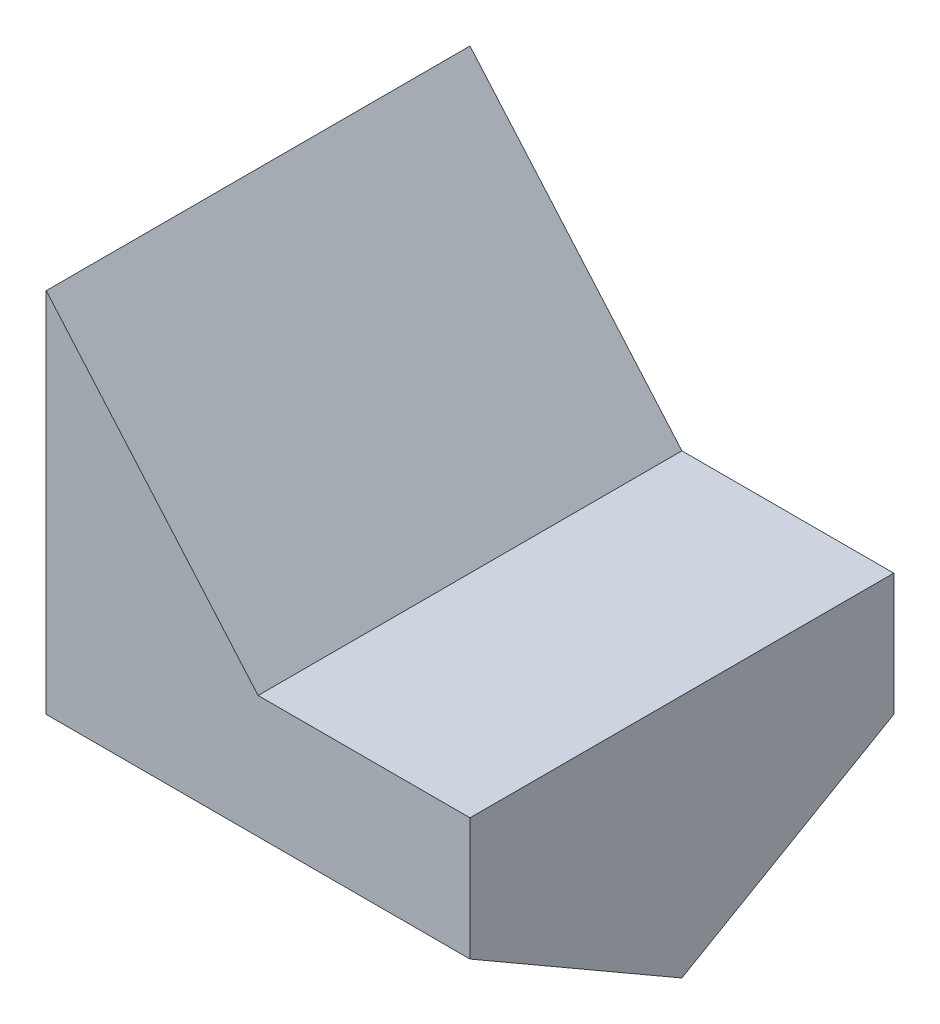
from build123d import *

# Parameters (mm, degrees)
EXTRUDE_2_DEPTH          = 60
CUT_EXTRUDE_2_DEPTH      = 76.498344353
CUT_EXTRUDE_2_DEPTH_BACK = 76.498344353


with BuildPart() as part:
    # Эскиз1 → Бобышка-Вытянуть2 (new body)
    with BuildSketch(Plane(origin=(0, 0, 0), x_dir=(0, 0, -1), z_dir=(1, 0, 0))):
        Polygon((-30, 34.641016151), (-30, -17.320508076), (0, -34.641016151), (30, -17.320508076), (30, 34.641016151), align=None)
    extrude(amount=EXTRUDE_2_DEPTH)

    # Эскиз3 → Вырез-Вытянуть2 (cut, two sides: drawn at the far end of the back side and taken through both)
    with BuildSketch(Plane.XY.offset(-CUT_EXTRUDE_2_DEPTH_BACK)):
        Polygon((60, 0), (30, 0), (0, 34.641016151), (60, 34.641016151), align=None)
    extrude(amount=CUT_EXTRUDE_2_DEPTH + CUT_EXTRUDE_2_DEPTH_BACK, mode=Mode.SUBTRACT)


solid = part.part
